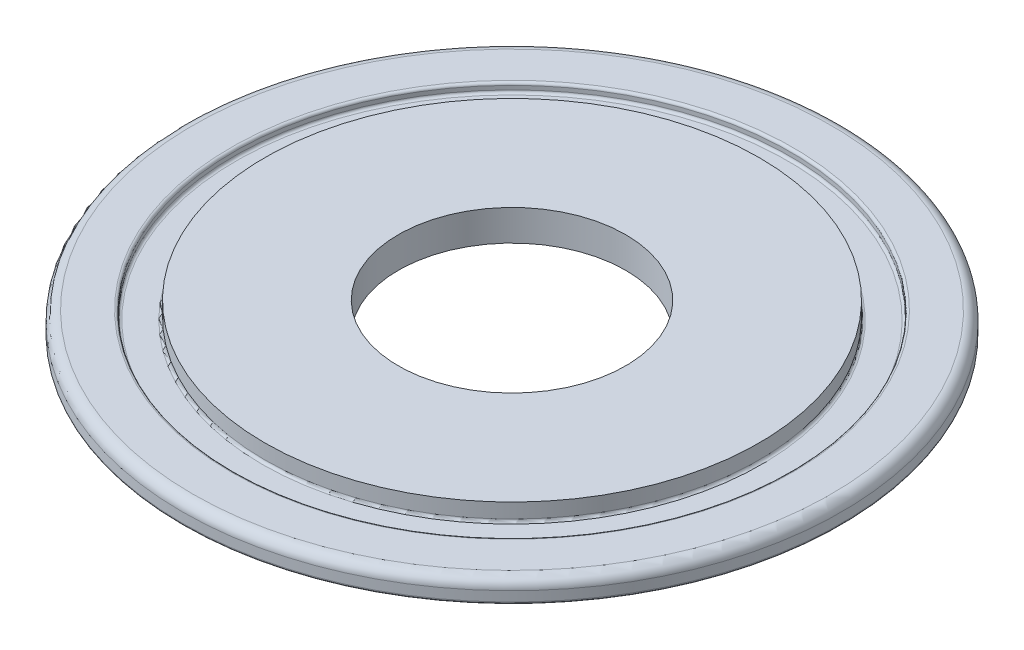
from build123d import *

# Parameters (mm, degrees)
FILLET1_R = 0.396875
FILLET2_R = 1.5875


with BuildPart() as part:
    # Sketch1 → Revolve1 (revolve)
    with BuildSketch(Plane.XY, mode=Mode.PRIVATE) as revolve1_sk:
        Polygon((17.526, 0), (17.526, 2.0955), (17.526, 4.7625), (38.1, 4.7625), (38.1, 2.0955), (42.926, 2.0955), (42.926, 3.4925), (50.8, 3.4925), (50.8, 0), align=None)
    revolve(revolve1_sk.sketch.rotate(Axis((0, 0, 0), (0, 1, 0)), 90), axis=Axis((0, 0, 0), (0, 1, 0)))

    # Fillet1
    fillet1_edges = [part.edges().sort_by_distance(p)[0] for p in [
        (0, 0, 50.8),
        (0, 3.4925, 42.926),
        (0, 2.0955, 42.926),
        (0, 2.0955, 38.1),
    ]]
    fillet(fillet1_edges, radius=FILLET1_R)

    # Fillet2
    fillet2_edges = [part.edges().sort_by_distance(p)[0] for p in [
        (0, 3.4925, 50.8),
    ]]
    fillet(fillet2_edges, radius=FILLET2_R)


solid = part.part
